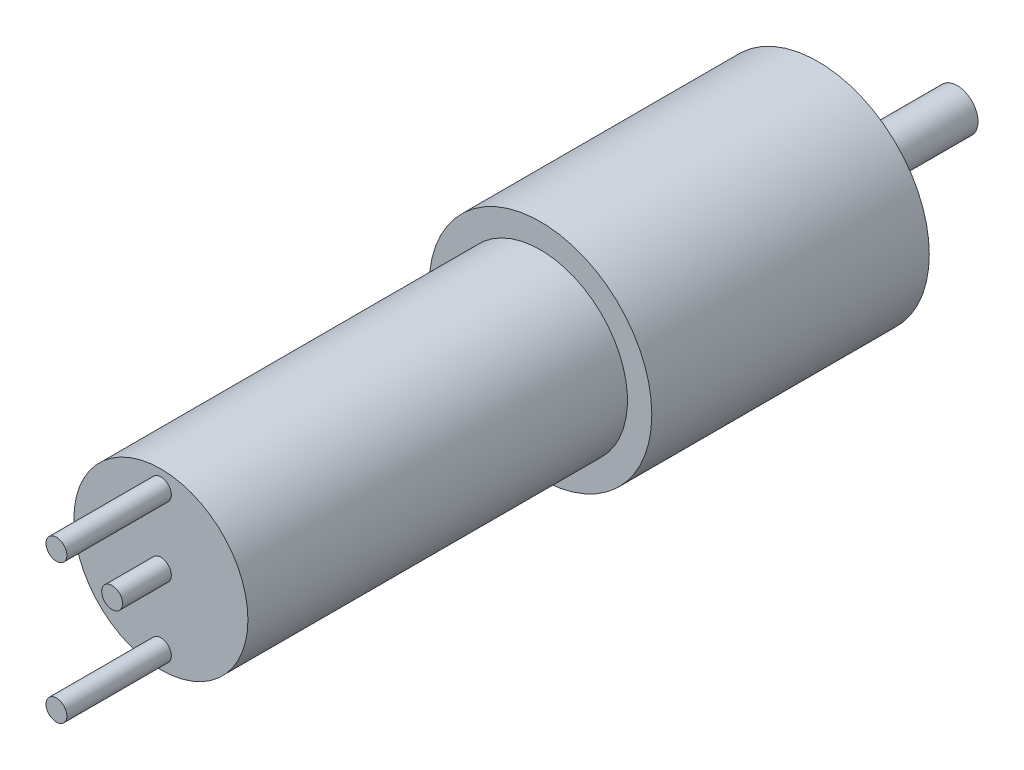
from build123d import *

# Parameters (mm, degrees)
ESQUISSE1_R        = 12.5
BOSS_EXTRU_1_DEPTH = 54.5
ESQUISSE2_R        = 1.5
BOSS_EXTRU_2_DEPTH = 7
ESQUISSE3_R        = 16
BOSS_EXTRU_3_DEPTH = 39.85
ESQUISSE4_R        = 10
BOSS_EXTRU_4_DEPTH = 3
ESQUISSE5_R        = 3
BOSS_EXTRU_5_DEPTH = 17
ESQUISSE6_R        = 1.5
BOSS_EXTRU_6_DEPTH = 15


with BuildPart() as part:
    # Esquisse1 → Boss.-Extru.1 (new body)
    with BuildSketch(Plane.XY):
        Circle(ESQUISSE1_R)
    extrude(amount=BOSS_EXTRU_1_DEPTH)

    # Esquisse2 → Boss.-Extru.2 (add)
    with BuildSketch(Plane.XY.offset(54.5)):
        Circle(ESQUISSE2_R)
    extrude(amount=BOSS_EXTRU_2_DEPTH)

    # Esquisse3 → Boss.-Extru.3 (add)
    with BuildSketch(Plane(origin=(0, 0, 0), x_dir=(-1, 0, 0), z_dir=(0, 0, -1))):
        Circle(ESQUISSE3_R)
    extrude(amount=BOSS_EXTRU_3_DEPTH)

    # Esquisse4 → Boss.-Extru.4 (add)
    with BuildSketch(Plane(origin=(0, 0, -39.85), x_dir=(-1, 0, 0), z_dir=(0, 0, -1))):
        Circle(ESQUISSE4_R)
    extrude(amount=BOSS_EXTRU_4_DEPTH)

    # Esquisse5 → Boss.-Extru.5 (add)
    with BuildSketch(Plane(origin=(0, 0, -42.85), x_dir=(-1, 0, 0), z_dir=(0, 0, -1))):
        Circle(ESQUISSE5_R)
    extrude(amount=BOSS_EXTRU_5_DEPTH)

    # Esquisse6 → Boss.-Extru.6 (add)
    with BuildSketch(Plane.XY.offset(54.5)):
        with Locations((0, 10)):
            Circle(ESQUISSE6_R)
        with Locations((0, -10)):
            Circle(ESQUISSE6_R)
    extrude(amount=BOSS_EXTRU_6_DEPTH)


solid = part.part
